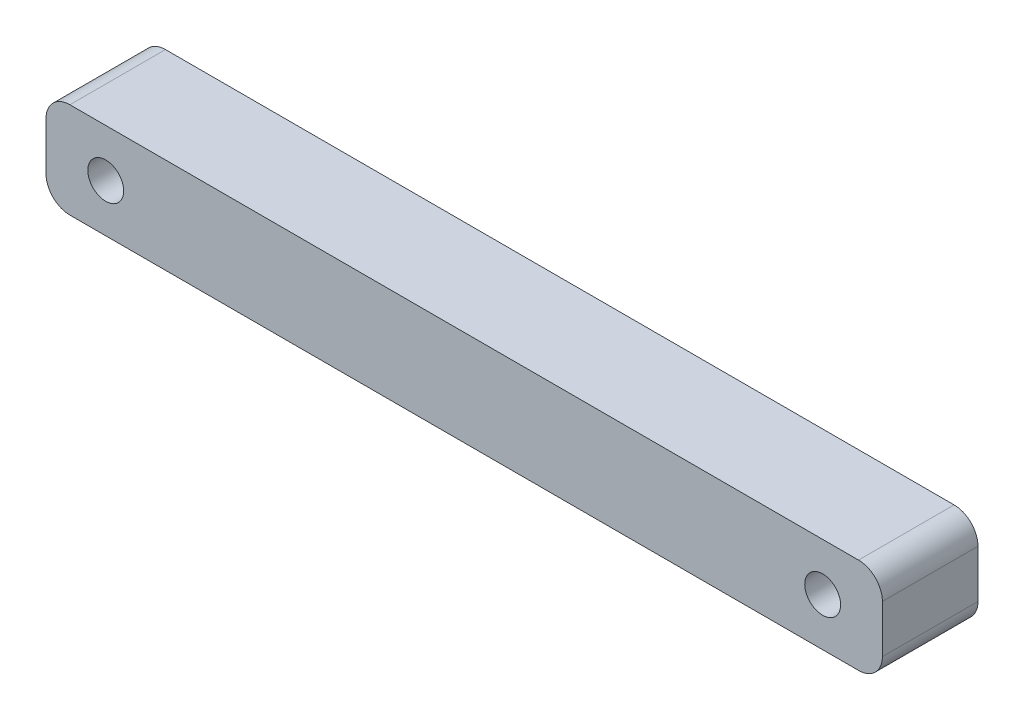
from build123d import *

# Parameters (mm, degrees)
SKETCH_1_W      = 70
SKETCH_1_H      = 8
SKETCH_1_R      = 1.5
EXTRUDE_1_DEPTH = 8
FILLET_1_R      = 2


with BuildPart() as part:
    # 草图1 → 凸台-拉伸1 (new body)
    with BuildSketch(Plane.XY):
        with Locations((35, -4)):
            Rectangle(SKETCH_1_W, SKETCH_1_H)
        with Locations((5, -4)):
            Circle(SKETCH_1_R, mode=Mode.SUBTRACT)
        with Locations(Location((65, -4, 0), (0, 0, 180))):
            Circle(SKETCH_1_R, mode=Mode.SUBTRACT)
    extrude(amount=EXTRUDE_1_DEPTH)

    # 圆角1
    fillet_1_edges = [part.edges().sort_by_distance(p)[0] for p in [
        (0, 0, 4),
        (70, 0, 4),
        (70, -8, 4),
        (0, -8, 4),
    ]]
    fillet(fillet_1_edges, radius=FILLET_1_R)


solid = part.part
